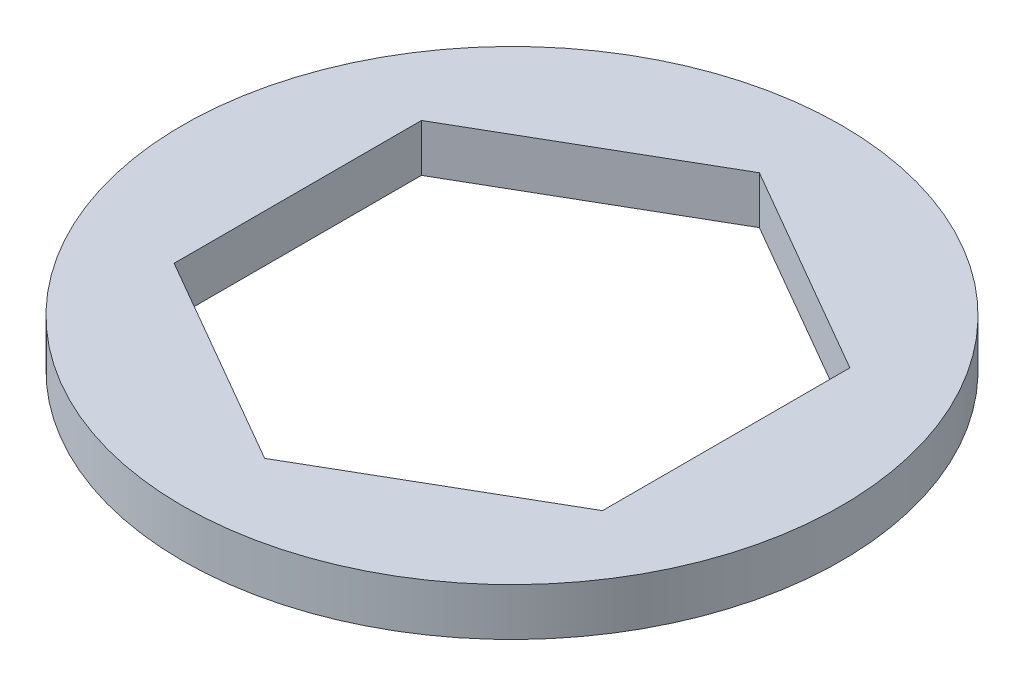
from build123d import *

# Parameters (mm, degrees)
SKETCH1_R           = 5.5
BOSS_EXTRUDE1_DEPTH = 0.79375


with BuildPart() as part:
    # Sketch1 → Boss-Extrude1 (new body)
    with BuildSketch(Plane(origin=(0, 0, 0), x_dir=(1, 0, 0), z_dir=(0, 1, 0))):
        with Locations(Location((0, 0, 0), (0, 0, 270))):
            Circle(SKETCH1_R)
        Polygon((0, 4.128054425), (-3.575, 2.064027212), (-3.575, -2.064027212), (0, -4.128054425), (3.575, -2.064027212), (3.575, 2.064027212), align=None, mode=Mode.SUBTRACT)
    extrude(amount=BOSS_EXTRUDE1_DEPTH)


solid = part.part
